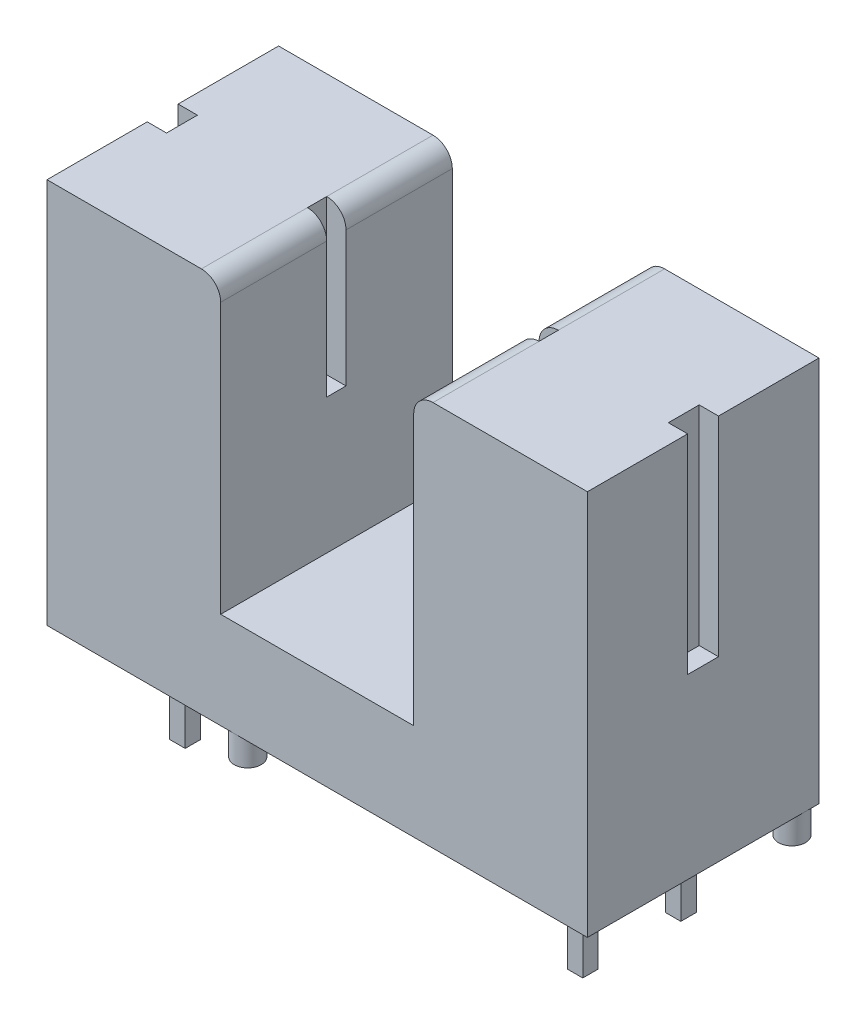
from build123d import *

# Parameters (mm, degrees)
EXTRUDE_1_DEPTH     = 6
FILLET_1_R          = 0.5
SKETCH_2_W          = 0.4
SKETCH_2_H          = 0.4
EXTRUDE_2_DEPTH     = 2.5
SKETCH_3_W          = 0.8
SKETCH_3_H          = 5.4
CUT_EXTRUDE_1_DEPTH = 0.5
SKETCH_4_W          = 0.8
SKETCH_4_H          = 5.4
CUT_EXTRUDE_2_DEPTH = 0.5
SKETCH_5_W          = 0.5
SKETCH_5_H          = 4
CUT_EXTRUDE_3_DEPTH = 0.5
SKETCH_6_W          = 0.5
SKETCH_6_H          = 4
CUT_EXTRUDE_4_DEPTH = 0.5
SKETCH_7_R          = 0.35
EXTRUDE_3_DEPTH     = 0.7


with BuildPart() as part:
    # 草图1 → 凸台-拉伸1 (new body)
    with BuildSketch(Plane.XY):
        Polygon((-7, 5), (-2.5, 5), (-2.5, -2.5), (2.5, -2.5), (2.5, 5), (7, 5), (7, -5), (-7, -5), align=None)
    extrude(amount=EXTRUDE_1_DEPTH)

    # 圆角1
    fillet_1_edges = [part.edges().sort_by_distance(p)[0] for p in [
        (-2.5, 5, 3),
        (2.5, 5, 3),
    ]]
    fillet(fillet_1_edges, radius=FILLET_1_R)

    # 草图2 → 凸台-拉伸2 (add)
    with BuildSketch(Plane.XZ.offset(5)):
        with Locations((-5.15, 4.27)):
            Rectangle(SKETCH_2_W, SKETCH_2_H)
        with Locations((5.15, 4.27)):
            Rectangle(SKETCH_2_W, SKETCH_2_H)
        with Locations((-5.15, 1.73)):
            Rectangle(SKETCH_2_W, SKETCH_2_H)
        with Locations((5.15, 1.73)):
            Rectangle(SKETCH_2_W, SKETCH_2_H)
    extrude(amount=EXTRUDE_2_DEPTH)

    # 草图3 → 切除-拉伸1 (cut)
    with BuildSketch(Plane.ZY.offset(7)):
        with Locations((3.003385533, 2.3)):
            Rectangle(SKETCH_3_W, SKETCH_3_H)
    extrude(amount=-CUT_EXTRUDE_1_DEPTH, mode=Mode.SUBTRACT)

    # 草图4 → 切除-拉伸2 (cut)
    with BuildSketch(Plane(origin=(7, 0, 0), x_dir=(0, 0, -1), z_dir=(1, 0, 0))):
        with Locations((-3.003385533, 2.3)):
            Rectangle(SKETCH_4_W, SKETCH_4_H)
    extrude(amount=-CUT_EXTRUDE_2_DEPTH, mode=Mode.SUBTRACT)

    # 草图5 → 切除-拉伸3 (cut)
    with BuildSketch(Plane(origin=(-2.5, 0, 0), x_dir=(0, 0, -1), z_dir=(1, 0, 0))):
        with Locations((-3.003385533, 3)):
            Rectangle(SKETCH_5_W, SKETCH_5_H)
    extrude(amount=-CUT_EXTRUDE_3_DEPTH, mode=Mode.SUBTRACT)

    # 草图6 → 切除-拉伸4 (cut)
    with BuildSketch(Plane.ZY.offset(-2.5)):
        with Locations((3.003385533, 3)):
            Rectangle(SKETCH_6_W, SKETCH_6_H)
    extrude(amount=-CUT_EXTRUDE_4_DEPTH, mode=Mode.SUBTRACT)

    # 草图7 → 凸台-拉伸3 (add)
    with BuildSketch(Plane.XZ.offset(5)):
        with Locations(Location((-2.15, 5.65, 0), (0, 0, 90))):
            Circle(SKETCH_7_R)
        with Locations(Location((6.65, 0.35, 0), (0, 0, 270))):
            Circle(SKETCH_7_R)
    extrude(amount=EXTRUDE_3_DEPTH)


solid = part.part
